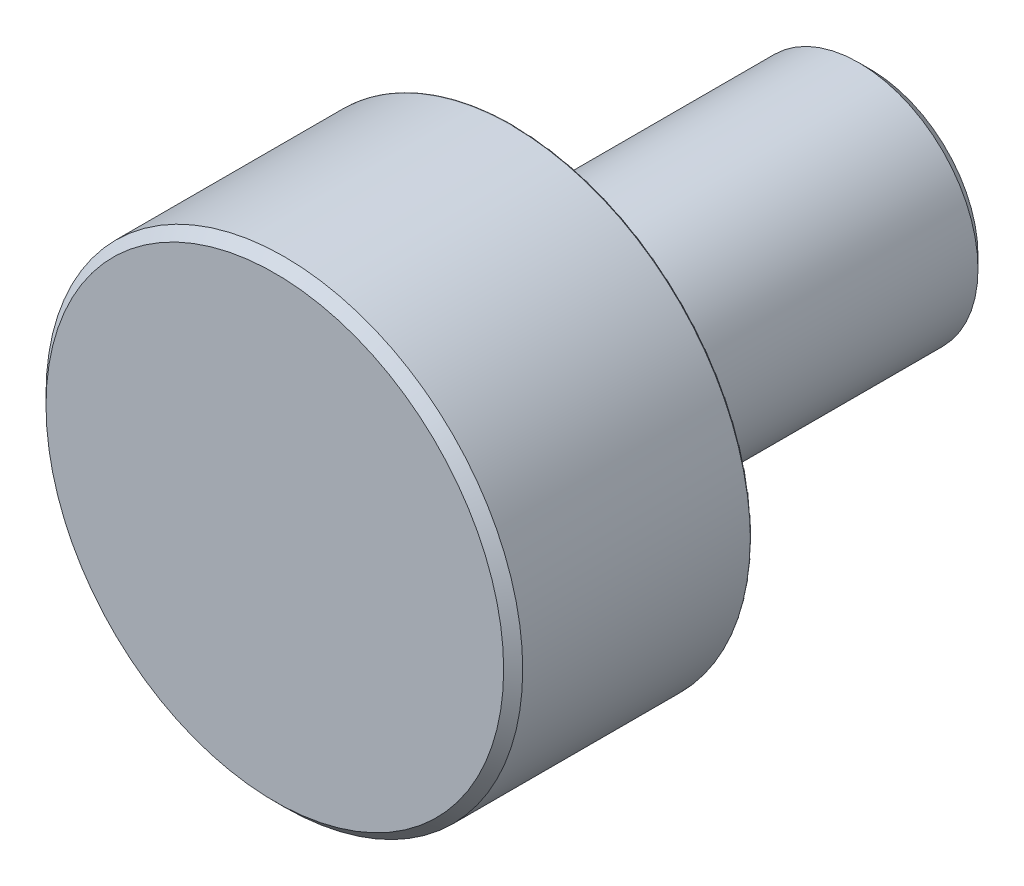
from build123d import *

# Parameters (mm, degrees)
CHAMFER1_SIZE = 0.32
CHAMFER2_SIZE = 0.4


with BuildPart() as part:
    # Sketch1 → Revolve1 (revolve)
    with BuildSketch(Plane(origin=(0, 0, 0), x_dir=(0, 0, -1), z_dir=(1, 0, 0)), mode=Mode.PRIVATE) as revolve1_sk:
        with BuildLine():
            Line((-8, 0), (-8, 8))
            Line((-8, 8), (-0.05, 8))
            ThreePointArc((-0.05, 8), (-0.014644661, 7.985355339), (0, 7.95))
            Line((0, 7.95), (0, 4.447213595))
            ThreePointArc((0, 4.447213595), (-0.0127322, 4.413880262), (-0.044444444, 4.397523196))
            ThreePointArc((-0.044444444, 4.397523196), (-0.399380319, 3.977743298), (0, 3.6))
            Line((0, 3.6), (0.8, 3.6))
            Line((0.8, 3.6), (0.8, 4))
            Line((0.8, 4), (12, 4))
            Line((12, 4), (12, 0))
            Line((12, 0), (-8, 0))
        make_face()
    revolve(revolve1_sk.sketch.rotate(Axis((0, 0, 12.7), (0, 0, -1)), 90), axis=Axis((0, 0, 12.7), (0, 0, -1)))

    # Chamfer1
    chamfer1_edges = [part.edges().sort_by_distance(p)[0] for p in [
        (-8, 0, 8),
    ]]
    chamfer(chamfer1_edges, length=CHAMFER1_SIZE)

    # Chamfer2
    chamfer2_edges = [part.edges().sort_by_distance(p)[0] for p in [
        (-4, 0, -12),
    ]]
    chamfer(chamfer2_edges, length=CHAMFER2_SIZE)


solid = part.part
